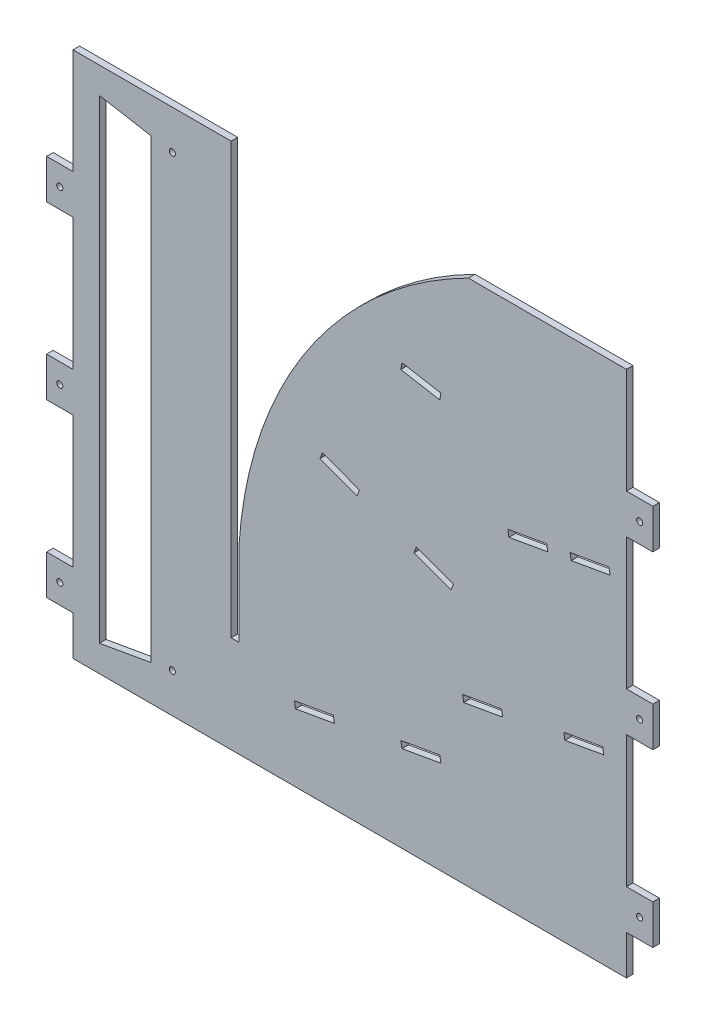
from build123d import *

# Parameters (mm, degrees)
BOSS_EXTRUDE1_DEPTH   = 3.175
CUT_EXTRUDE5_DEPTH    = 378.611494297
F_4_CLEARANCE_HOLE1_D = 2.9464
CUT_EXTRUDE15_DEPTH   = 378.611494297


with BuildPart() as part:
    # Sketch1 → Boss-Extrude1 (new body)
    with BuildSketch(Plane.XY):
        with BuildLine():
            Line((76.2, 254), (76.2, 46.734177824))
            Line((76.2, 46.734177824), (80.01, 46.734177824))
            Line((80.01, 46.734177824), (80.01, 87.374980319))
            ThreePointArc((80.01, 87.374980319), (113.133038802, 185.356688684), (190.5, 254))
            Line((190.5, 254), (266.7, 254))
            Line((266.7, 254), (266.7, 203.2))
            Line((266.7, 203.2), (279.4, 203.2))
            Line((279.4, 203.2), (279.4, 184.15))
            Line((279.4, 184.15), (266.7, 184.15))
            Line((266.7, 184.15), (266.7, 120.65))
            Line((266.7, 120.65), (279.4, 120.65))
            Line((279.4, 120.65), (279.4, 101.6))
            Line((279.4, 101.6), (266.7, 101.6))
            Line((266.7, 101.6), (266.7, 38.1))
            Line((266.7, 38.1), (279.4, 38.1))
            Line((279.4, 38.1), (279.4, 19.05))
            Line((279.4, 19.05), (266.7, 19.05))
            Line((266.7, 19.05), (266.7, 0))
            Line((266.7, 0), (0, 0))
            Line((0, 0), (0, 19.05))
            Line((0, 19.05), (-12.7, 19.05))
            Line((-12.7, 19.05), (-12.7, 38.1))
            Line((-12.7, 38.1), (0, 38.1))
            Line((0, 38.1), (0, 101.6))
            Line((0, 101.6), (-12.7, 101.6))
            Line((-12.7, 101.6), (-12.7, 120.65))
            Line((-12.7, 120.65), (0, 120.65))
            Line((0, 120.65), (0, 184.15))
            Line((0, 184.15), (-12.7, 184.15))
            Line((-12.7, 184.15), (-12.7, 203.2))
            Line((-12.7, 203.2), (0, 203.2))
            Line((0, 203.2), (0, 254))
            Line((0, 254), (76.2, 254))
        make_face()
    extrude(amount=BOSS_EXTRUDE1_DEPTH)

    # Sketch10 → Cut-Extrude5 (cut, through all)
    with BuildSketch(Plane.XY.offset(3.175)):
        Polygon((12.7, 12.7), (12.7, 241.3), (37.714116927, 236.889336287), (37.714116927, 17.110663713), align=None)
    extrude(amount=-CUT_EXTRUDE5_DEPTH, mode=Mode.SUBTRACT)

    # #4 Clearance Hole1 (through all)
    with Locations(Plane.XY.offset(3.175)):
        with Locations((-6.35, 193.675), (-6.35, 111.125), (-6.35, 28.575), (273.05, 193.675), (273.05, 111.125), (273.05, 28.575), (47.874116927, 235.097854163), (47.874116927, 18.902145837)):
            Hole(F_4_CLEARANCE_HOLE1_D / 2)

    # Sketch21 → Cut-Extrude15 (cut, through all)
    with BuildSketch(Plane.XY.offset(3.175)):
        Polygon((158.526152675, 202.69099682), (157.974819711, 199.564232204), (176.735407405, 196.256234419), (177.286740369, 199.382999035), align=None)
        Polygon((239.522435721, 163.996596363), (240.073768685, 160.869831747), (258.83435638, 164.177829531), (258.283023416, 167.304594147), align=None)
        Polygon((120.16783778, 145.92910773), (119.067835825, 142.950749004), (136.937988179, 136.350737274), (138.037990134, 139.329096), align=None)
        Polygon((165.43889041, 129.209078013), (164.338888455, 126.230719288), (182.20904081, 119.630707557), (183.309042765, 122.609066283), align=None)
        Polygon((236.492169338, 87.476937109), (237.043502302, 84.350172493), (255.804089997, 87.658170277), (255.252757033, 90.784934893), align=None)
        Polygon((187.714641331, 78.876142869), (188.265974296, 75.749378253), (207.02656199, 79.057376038), (206.475229026, 82.184140653), align=None)
        Polygon((228.266083104, 162.011797692), (228.817416068, 158.885033076), (210.056828373, 155.577035291), (209.505495409, 158.703799907), align=None)
        Polygon((106.695880011, 35.721968707), (107.247212975, 32.595204091), (126.00780067, 35.903201876), (125.456467706, 39.029966491), align=None)
        Polygon((157.974819711, 44.763829318), (158.526152675, 41.637064702), (177.286740369, 44.945062487), (176.735407405, 48.071827103), align=None)
    extrude(amount=-CUT_EXTRUDE15_DEPTH, mode=Mode.SUBTRACT)


solid = part.part
